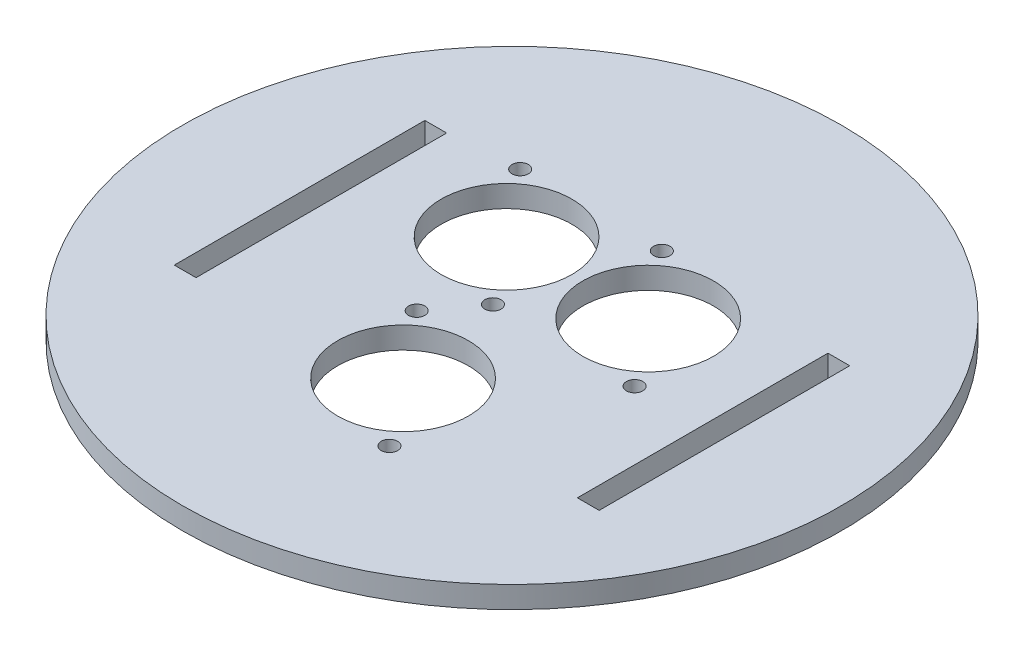
from build123d import *

# Parameters (mm, degrees)
SKETCH1_R             = 60.5
BOSS_EXTRUDE1_DEPTH   = 4
SKETCH2_R             = 12
CUT_EXTRUDE1_DEPTH    = 4
F_3_0MM_DOWEL_HOLE1_D = 3
SKETCH6_W             = 4
SKETCH6_H             = 46
CUT_EXTRUDE2_DEPTH    = 4


with BuildPart() as part:
    # Sketch1 → Boss-Extrude1 (new body)
    with BuildSketch(Plane(origin=(0, 0, 0), x_dir=(1, 0, 0), z_dir=(0, 1, 0))):
        with Locations(Location((0, 0, 0), (0, 0, 270))):
            Circle(SKETCH1_R)
    extrude(amount=BOSS_EXTRUDE1_DEPTH)

    # Sketch2 → Cut-Extrude1 (cut)
    with BuildSketch(Plane(origin=(0, 4, 0), x_dir=(1, 0, 0), z_dir=(0, 1, 0))):
        with Locations(Location((0, -20, 0), (0, 0, 270))):
            Circle(SKETCH2_R)
        with Locations(Location((13, 12, 0), (0, 0, 270))):
            Circle(SKETCH2_R)
        with Locations(Location((-13, 12, 0), (0, 0, 270))):
            Circle(SKETCH2_R)
    extrude(amount=-CUT_EXTRUDE1_DEPTH, mode=Mode.SUBTRACT)

    # Ø3.0mm Dowel Hole1 (through all)
    with Locations(Plane(origin=(-22.5, 4, -24), x_dir=(0, 0, 1), z_dir=(0, 1, 0))):
        with Locations((0, 0), (24, 19), (0, 26), (24, 45), (32, 13), (56, 32)):
            Hole(F_3_0MM_DOWEL_HOLE1_D / 2)

    # Sketch6 → Cut-Extrude2 (cut)
    with BuildSketch(Plane(origin=(0, 4, 0), x_dir=(1, 0, 0), z_dir=(0, 1, 0))):
        with Locations((-37, 0)):
            Rectangle(SKETCH6_W, SKETCH6_H)
    cut_extrude2 = extrude(amount=-CUT_EXTRUDE2_DEPTH, mode=Mode.SUBTRACT)

    # Mirror1: Cut-Extrude2 across plane
    add(cut_extrude2.mirror(Plane(origin=(0, 0, 0), x_dir=(0, 0, 1), z_dir=(1, 0, 0))), mode=Mode.SUBTRACT)


solid = part.part
